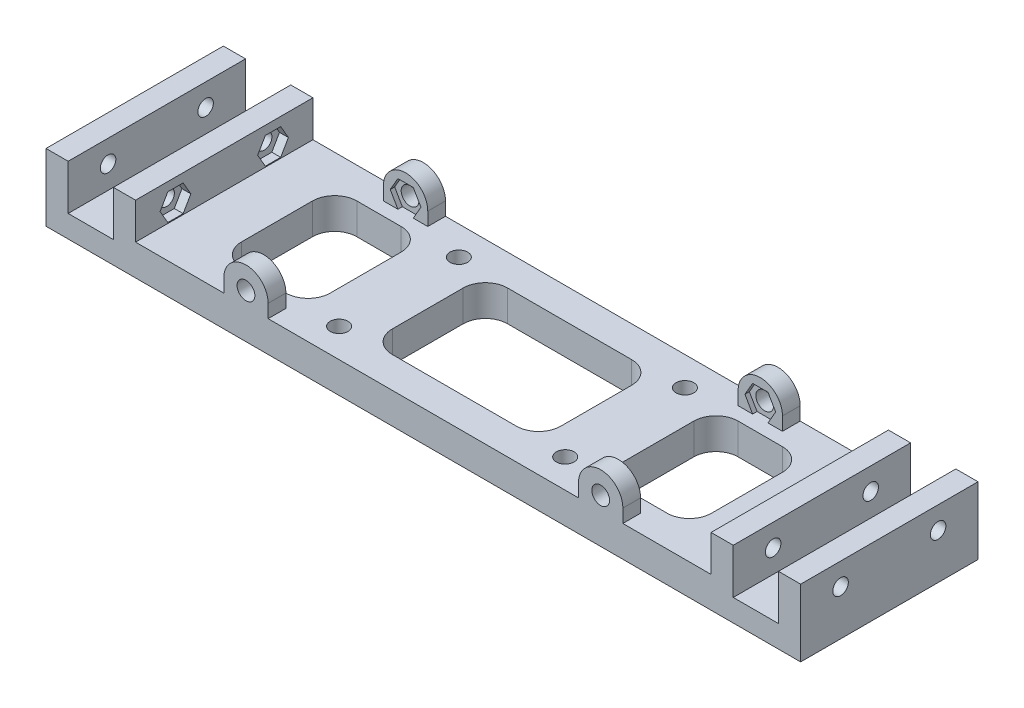
from build123d import *

# Parameters (mm, degrees)
DODANIE_WYCI_GNI_CIE1_DEPTH = 40
SZKIC2_R                    = 2
WYTNIJ_WYCI_GNI_CIE1_DEPTH  = 35
SZKIC3_W                    = 38
SZKIC3_H                    = 26
SZKIC3_W_2                  = 20
WYTNIJ_WYCI_GNI_CIE2_DEPTH  = 35
ZAOKR_GLENIE1_R             = 5
SZKIC4_R                    = 1.75
WYTNIJ_WYCI_GNI_CIE3_DEPTH  = 35
WYTNIJ_WYCI_GNI_CIE4_START  = -20.200203
WYTNIJ_WYCI_GNI_CIE4_DEPTH  = 2
WYTNIJ_WYCI_GNI_CIE5_START  = -150
WYTNIJ_WYCI_GNI_CIE5_DEPTH  = 2
SZKIC7_R                    = 2
DODANIE_WYCI_GNI_CIE4_DEPTH = 4
WYTNIJ_WYCI_GNI_CIE6_DEPTH  = 1


with BuildPart() as part:
    # Szkic1 → Dodanie-wyciągnięcie1 (new body)
    with BuildSketch(Plane.XY):
        Polygon((-64.9, -3.1), (-64.9, 5.1), (-69.9, 5.1), (-69.9, -5.1), (-80.1, -5.1), (-80.1, 5.1), (-85.1, 5.1), (-85.1, -10.1), (85.1, -10.1), (85.1, 5.100203132), (80.100203132, 5.100203132), (80.100203132, -5.100203132), (69.899796868, -5.100203132), (69.899796868, 5.100203132), (64.899796868, 5.100203132), (64.899796868, -3.1), align=None)
    extrude(amount=DODANIE_WYCI_GNI_CIE1_DEPTH)

    # Szkic2 → Wytnij-wyciągnięcie1 (cut)
    with BuildSketch(Plane.XZ.offset(10.1)):
        with Locations(Location((-25.5, 33.5, 0), (0, 0, 270))):
            Circle(SZKIC2_R)
        with Locations(Location((-25.5, 6.5, 0), (0, 0, 270))):
            Circle(SZKIC2_R)
        with Locations(Location((25.5, 6.5, 0), (0, 0, 270))):
            Circle(SZKIC2_R)
        with Locations(Location((25.5, 33.5, 0), (0, 0, 270))):
            Circle(SZKIC2_R)
    extrude(amount=-WYTNIJ_WYCI_GNI_CIE1_DEPTH, mode=Mode.SUBTRACT)

    # Szkic3 → Wytnij-wyciągnięcie2 (cut)
    with BuildSketch(Plane.XZ.offset(10.1)):
        with Locations((0, 20)):
            Rectangle(SZKIC3_W, SZKIC3_H)
        with Locations((-43, 20)):
            Rectangle(SZKIC3_W_2, SZKIC3_H)
        with Locations((43, 20)):
            Rectangle(SZKIC3_W_2, SZKIC3_H)
    extrude(amount=-WYTNIJ_WYCI_GNI_CIE2_DEPTH, mode=Mode.SUBTRACT)

    # Zaokrąglenie1
    zaokr_glenie1_edges = [part.edges().sort_by_distance(p)[0] for p in [
        (19, -6.6, 33),
        (19, -6.6, 7),
        (-19, -6.6, 7),
        (-19, -6.6, 33),
        (53, -6.6, 33),
        (53, -6.6, 7),
        (33, -6.6, 7),
        (33, -6.6, 33),
        (-33, -6.6, 33),
        (-33, -6.6, 7),
        (-53, -6.6, 7),
        (-53, -6.6, 33),
    ]]
    fillet(zaokr_glenie1_edges, radius=ZAOKR_GLENIE1_R)

    # Szkic4 → Wytnij-wyciągnięcie3 (cut)
    with BuildSketch(Plane(origin=(85.1, 0, 0), x_dir=(0, 0, -1), z_dir=(1, 0, 0))):
        with Locations((-31, 0.100203132)):
            Circle(SZKIC4_R)
        with Locations((-9, 0.100203132)):
            Circle(SZKIC4_R)
    wytnij_wyci_gni_cie3 = extrude(amount=-WYTNIJ_WYCI_GNI_CIE3_DEPTH, mode=Mode.SUBTRACT)

    # Szkic5 → Wytnij-wyciągnięcie4 (cut)
    with BuildSketch(Plane(origin=(85.1, 0, 0), x_dir=(0, 0, -1), z_dir=(1, 0, 0)).offset(WYTNIJ_WYCI_GNI_CIE4_START)):
        Polygon((-29.267949192, 3.100203132), (-32.732050808, 3.100203132), (-34.464101615, 0.100203132), (-32.732050808, -2.899796868), (-29.267949192, -2.899796868), (-27.535898385, 0.100203132), align=None)
        Polygon((-7.267949192, 3.100203132), (-10.732050808, 3.100203132), (-12.464101615, 0.100203132), (-10.732050808, -2.899796868), (-7.267949192, -2.899796868), (-5.535898385, 0.100203132), align=None)
    extrude(amount=WYTNIJ_WYCI_GNI_CIE4_DEPTH, mode=Mode.SUBTRACT)

    # Lustro1: Wytnij-wyciągnięcie3 across plane
    add(wytnij_wyci_gni_cie3.mirror(Plane(origin=(0, 0, 0), x_dir=(0, 0, 1), z_dir=(1, 0, 0))), mode=Mode.SUBTRACT)

    # Szkic5<2> → Wytnij-wyciągnięcie5 (cut)
    with BuildSketch(Plane(origin=(85.1, 0, 0), x_dir=(0, 0, -1), z_dir=(1, 0, 0)).offset(WYTNIJ_WYCI_GNI_CIE5_START)):
        Polygon((-29.267949192, 3.100203132), (-32.732050808, 3.100203132), (-34.464101615, 0.100203132), (-32.732050808, -2.899796868), (-29.267949192, -2.899796868), (-27.535898385, 0.100203132), align=None)
        Polygon((-7.267949192, 3.100203132), (-10.732050808, 3.100203132), (-12.464101615, 0.100203132), (-10.732050808, -2.899796868), (-7.267949192, -2.899796868), (-5.535898385, 0.100203132), align=None)
    extrude(amount=-WYTNIJ_WYCI_GNI_CIE5_DEPTH, mode=Mode.SUBTRACT)

    # Szkic7 → Dodanie-wyciągnięcie4 (add)
    # profile 1 of 2: a face of its own
    with BuildSketch(Plane.XY.offset(40)):
        with BuildLine():
            Line((35, -0.1), (35, -3.1))
            Line((35, -3.1), (45, -3.1))
            Line((45, -3.1), (45, -0.1))
            ThreePointArc((45, -0.1), (40, 4.9), (35, -0.1))
        make_face()
        with Locations((40, -0.1)):
            Circle(SZKIC7_R, mode=Mode.SUBTRACT)
    # profile 2 of 2: a face of its own
    with BuildSketch(Plane.XY.offset(40)):
        with BuildLine():
            ThreePointArc((-35, -0.1), (-40, 4.9), (-45, -0.1))
            Line((-45, -0.1), (-45, -3.1))
            Line((-45, -3.1), (-35, -3.1))
            Line((-35, -3.1), (-35, -0.1))
        make_face()
        with Locations((-40, -0.1)):
            Circle(SZKIC7_R, mode=Mode.SUBTRACT)
    dodanie_wyci_gni_cie4 = extrude(amount=-DODANIE_WYCI_GNI_CIE4_DEPTH)

    # Szkic8 → Wytnij-wyciągnięcie6 (cut)
    with BuildSketch(Plane(origin=(0, 0, 36), x_dir=(-1, 0, 0), z_dir=(0, 0, -1))):
        Polygon((-36.535898385, -0.1), (-38.267949192, 2.9), (-41.732050808, 2.9), (-43.464101615, -0.1), (-41.732050808, -3.1), (-38.267949192, -3.1), align=None)
        Polygon((43.464101615, -0.1), (41.732050808, 2.9), (38.267949192, 2.9), (36.535898385, -0.1), (38.267949192, -3.1), (41.732050808, -3.1), align=None)
    wytnij_wyci_gni_cie6 = extrude(amount=-WYTNIJ_WYCI_GNI_CIE6_DEPTH, mode=Mode.SUBTRACT)

    # Lustro3: Dodanie-wyciągnięcie4, Wytnij-wyciągnięcie6 across plane
    add(dodanie_wyci_gni_cie4.mirror(Plane(origin=(0, 0, 20), x_dir=(1, 0, 0), z_dir=(0, 0, -1))))
    add(wytnij_wyci_gni_cie6.mirror(Plane(origin=(0, 0, 20), x_dir=(1, 0, 0), z_dir=(0, 0, -1))), mode=Mode.SUBTRACT)


solid = part.part
